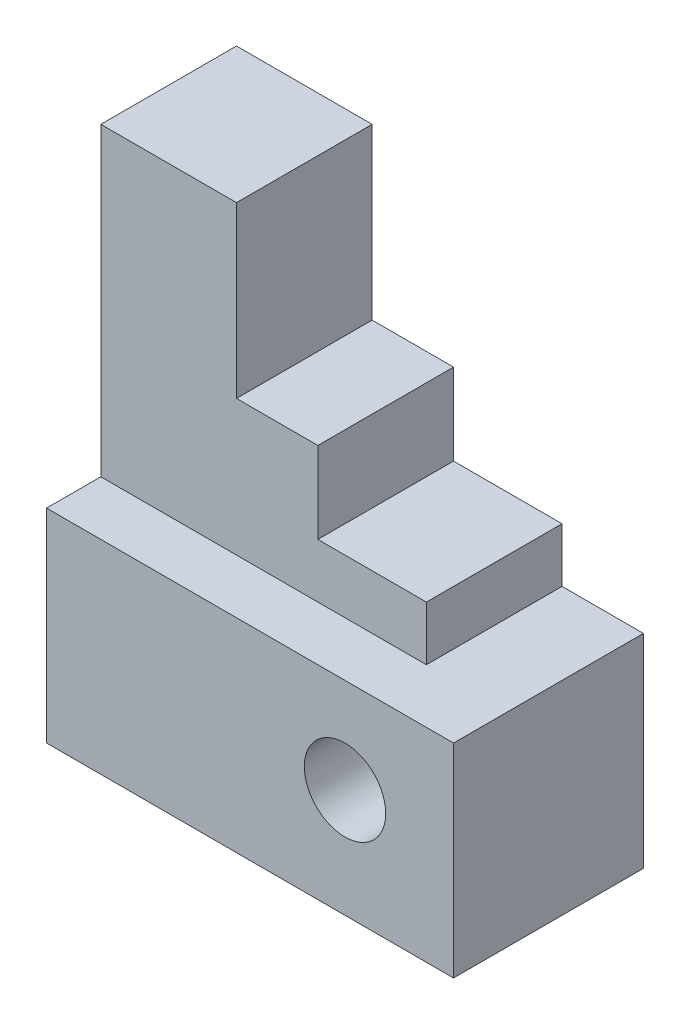
from build123d import *

# Parameters (mm, degrees)
SKETCH2_R           = 6
BOSS_EXTRUDE3_DEPTH = 28
BOSS_EXTRUDE4_DEPTH = 20


with BuildPart() as part:
    # Sketch2 → Boss-Extrude3 (new body)
    with BuildSketch(Plane.XY):
        Polygon((0, 30), (0, 0), (60, 0), (60, 30), (48, 30), align=None)
        with Locations((44, 16)):
            Circle(SKETCH2_R, mode=Mode.SUBTRACT)
    extrude(amount=BOSS_EXTRUDE3_DEPTH)

    # Sketch2<5> → Boss-Extrude4 (add)
    with BuildSketch(Plane.XY):
        Polygon((0, 30), (48, 30), (48, 38), (32, 38), (32, 50), (20, 50), (20, 75), (0, 75), align=None)
    extrude(amount=BOSS_EXTRUDE4_DEPTH)


solid = part.part
